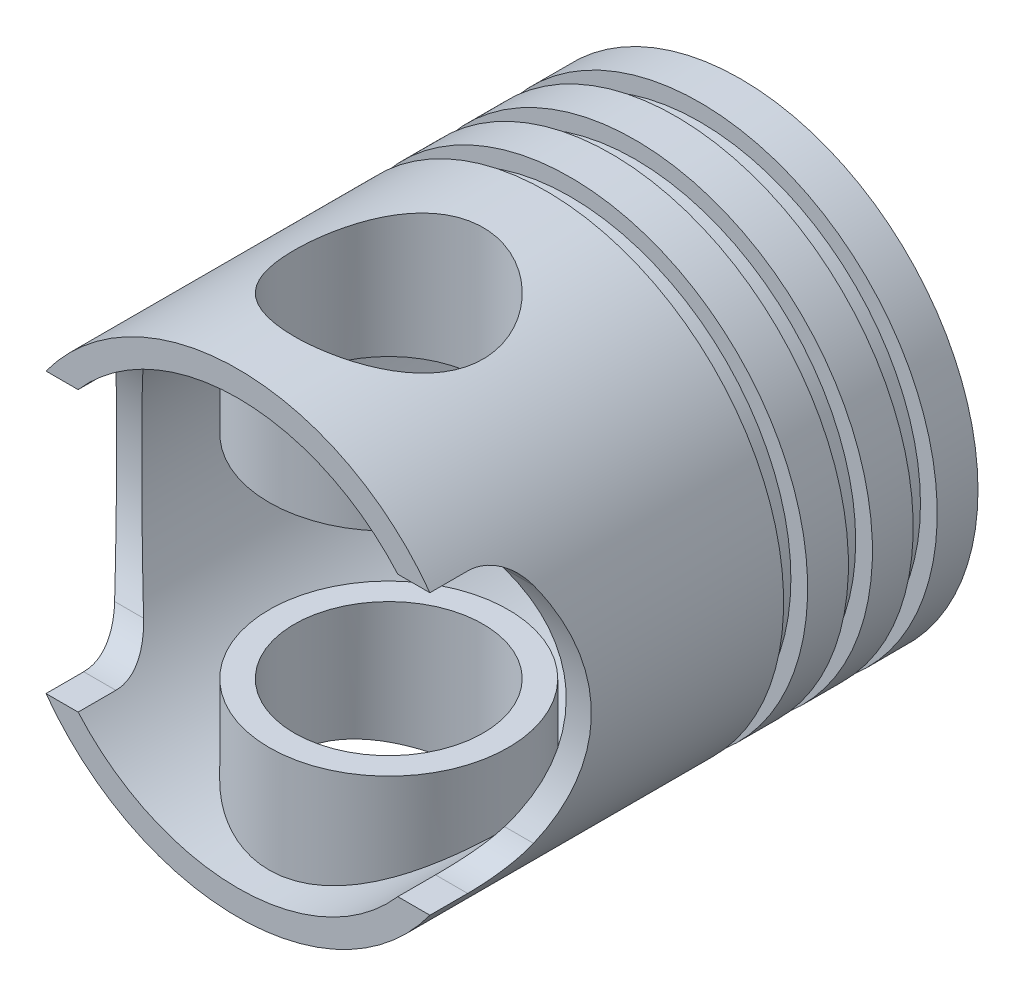
from build123d import *

# Parameters (mm, degrees)
CUT_EXTRUDE1_DEPTH       = 113.41663578
CUT_EXTRUDE1_DEPTH_BACK  = 113.41663578
SKETCH3_R                = 16.9
SKETCH4_R                = 38
CUT_EXTRUDE2_DEPTH       = 85
BOSS_EXTRUDE2_REACH      = 133.417
BOSS_EXTRUDE2_END_RADIUS = 38
BOSS_EXTRUDE2_START      = 19
SKETCH5_R                = 21.4
SKETCH5_R_2              = 16.9
CUT_EXTRUDE3_START       = -25
CUT_EXTRUDE3_DEPTH       = 88.416635855


with BuildPart() as part:
    # Sketch2 → Revolve1 (revolve)
    with BuildSketch(Plane(origin=(0, 0, 0), x_dir=(1, 0, 0), z_dir=(0, 1, 0))):
        with BuildLine():
            Line((0, 90), (0, 95))
            ThreePointArc((0, 95), (-21.396553461, 93.745704417), (-42.5, 90))
            Line((-42.5, 90), (-42.5, 82.7))
            Line((-42.5, 82.7), (-39.5, 82.7))
            Line((-39.5, 82.7), (-39.5, 78.4))
            Line((-39.5, 78.4), (-42.5, 78.4))
            Line((-42.5, 78.4), (-42.5, 71.1))
            Line((-42.5, 71.1), (-39.5, 71.1))
            Line((-39.5, 71.1), (-39.5, 66.8))
            Line((-39.5, 66.8), (-42.5, 66.8))
            Line((-42.5, 66.8), (-42.5, 59.5))
            Line((-42.5, 59.5), (-39.5, 59.5))
            Line((-39.5, 59.5), (-39.5, 55.2))
            Line((-39.5, 55.2), (-42.5, 55.2))
            Line((-42.5, 55.2), (-42.5, 0))
            Line((-42.5, 0), (0, 0))
            Line((0, 0), (0, 90))
        make_face()
    revolve(axis=Axis((0, 0, -90), (0, 0, 1)))

    # Sketch3 → Cut-Extrude1 (cut, two sides: drawn at the far end of the back side and taken through both)
    with BuildSketch(Plane(origin=(0, 0, 0), x_dir=(1, 0, 0), z_dir=(0, 1, 0)).offset(-CUT_EXTRUDE1_DEPTH_BACK)):
        with Locations(Location((0, 27, 0), (0, 0, 270))):
            Circle(SKETCH3_R)
    extrude(amount=CUT_EXTRUDE1_DEPTH + CUT_EXTRUDE1_DEPTH_BACK, mode=Mode.SUBTRACT)

    # Sketch4 → Cut-Extrude2 (cut)
    with BuildSketch(Plane.XY):
        Circle(SKETCH4_R)
    extrude(amount=-CUT_EXTRUDE2_DEPTH, mode=Mode.SUBTRACT)

    # Boss-Extrude2: up to this cylinder (the profile starts inside it)
    boss_extrude2_end = Plane(origin=(0, 0, -6.205283), z_dir=(0, 0, 1)) * Cylinder(BOSS_EXTRUDE2_END_RADIUS, 343.834, mode=Mode.PRIVATE)
    # Sketch5 → Boss-Extrude2 (add, up to the surface)
    with BuildSketch(Plane(origin=(0, 0, 0), x_dir=(1, 0, 0), z_dir=(0, 1, 0)).offset(BOSS_EXTRUDE2_START), mode=Mode.PRIVATE) as boss_extrude2_sk1:
        with Locations(Location((0, 27, 0), (0, 0, 90))):
            Circle(SKETCH5_R)
        with Locations(Location((0, 27, 0), (0, 0, 270))):
            Circle(SKETCH5_R_2, mode=Mode.SUBTRACT)
    boss_extrude2_tool1 = extrude(boss_extrude2_sk1.sketch, amount=BOSS_EXTRUDE2_REACH, mode=Mode.PRIVATE) & boss_extrude2_end
    boss_extrude2 = boss_extrude2_tool1.solids().sort_by_distance((0, 19, -6.205283))[0]
    add(boss_extrude2)

    # Mirror1: Boss-Extrude2 across plane
    add(boss_extrude2.mirror(Plane.ZX))

    # Sketch6 → Cut-Extrude3 (cut, through all)
    with BuildSketch(Plane(origin=(0, 0, 0), x_dir=(0, 0, -1), z_dir=(1, 0, 0)).offset(CUT_EXTRUDE3_START)):
        with BuildLine():
            Line((0, -25), (0, 25))
            Line((0, 25), (6.755772122, 25))
            ThreePointArc((6.755772122, 25), (11.755772122, 23.660254038), (15.416026159, 20))
            ThreePointArc((15.416026159, 20), (20.775010008, 0), (15.416026159, -20))
            ThreePointArc((15.416026159, -20), (11.755772122, -23.660254038), (6.755772122, -25))
            Line((6.755772122, -25), (0, -25))
        make_face()
    cut_extrude3 = extrude(amount=-CUT_EXTRUDE3_DEPTH, mode=Mode.SUBTRACT)

    # Mirror2: Cut-Extrude3 across plane
    add(cut_extrude3.mirror(Plane(origin=(0, 0, 0), x_dir=(0, 0, 1), z_dir=(1, 0, 0))), mode=Mode.SUBTRACT)


solid = part.part
